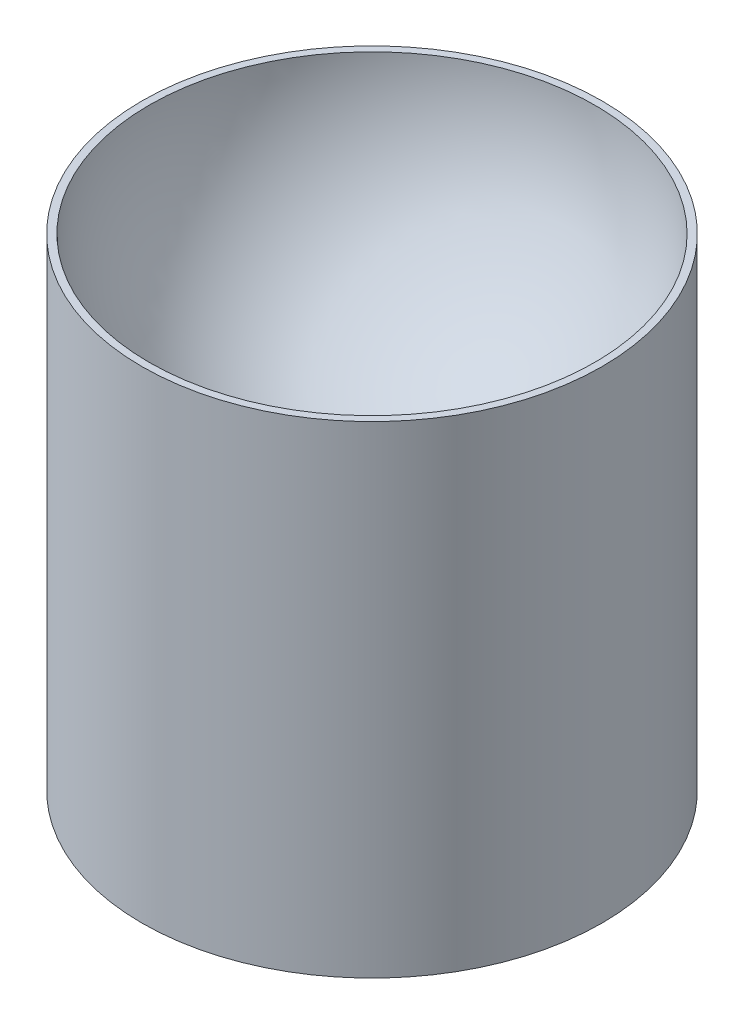
from build123d import *


with BuildPart() as part:
    # Sketch1 → Revolve1 (revolve)
    with BuildSketch(Plane.XY):
        with BuildLine():
            Line((-31.685, 33.185), (-31.685, -33.185))
            Line((-31.685, -33.185), (-30.685, -33.185))
            ThreePointArc((-30.685, -33.185), (-21.697571581, -11.487428419), (0, -2.5))
            Line((0, -2.5), (0, 2.5))
            ThreePointArc((0, 2.5), (-21.697571581, 11.487428419), (-30.685, 33.185))
            Line((-30.685, 33.185), (-31.685, 33.185))
        make_face()
    revolve(axis=Axis((0, 2.5, 0), (0, -1, 0)))


solid = part.part
